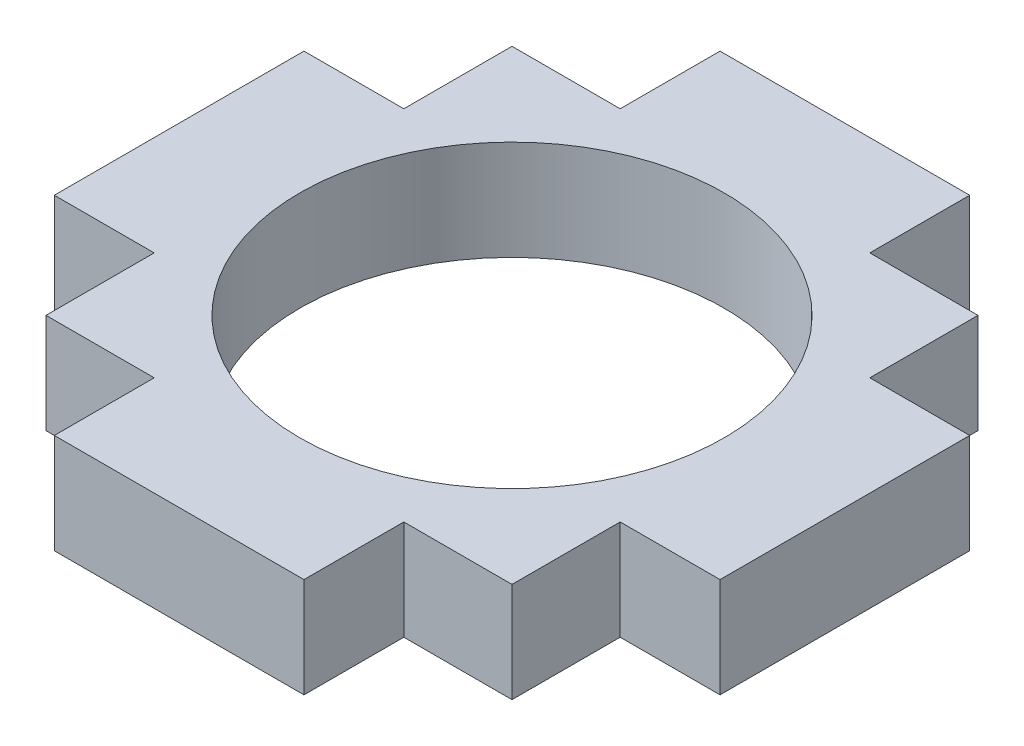
from build123d import *

# Parameters (mm, degrees)
CROQUIS1_R              = 12.75
SALIENTE_EXTRUIR1_DEPTH = 6


with BuildPart() as part:
    # Croquis1 → Saliente-Extruir1 (new body)
    with BuildSketch(Plane(origin=(0, 0, 0), x_dir=(1, 0, 0), z_dir=(0, 1, 0))):
        Polygon((27.5, 40), (12.5, 40), (12.5, 34), (6, 34), (6, 27.5), (0, 27.5), (0, 12.5), (6, 12.5), (6, 6), (12.5, 6), (12.5, 0), (27.5, 0), (27.5, 6), (34, 6), (34, 12.5), (40, 12.5), (40, 27.5), (34, 27.5), (34, 34), (27.5, 34), align=None)
        with Locations(Location((20, 20, 0), (0, 0, 270))):
            Circle(CROQUIS1_R, mode=Mode.SUBTRACT)
    extrude(amount=SALIENTE_EXTRUIR1_DEPTH)


solid = part.part
